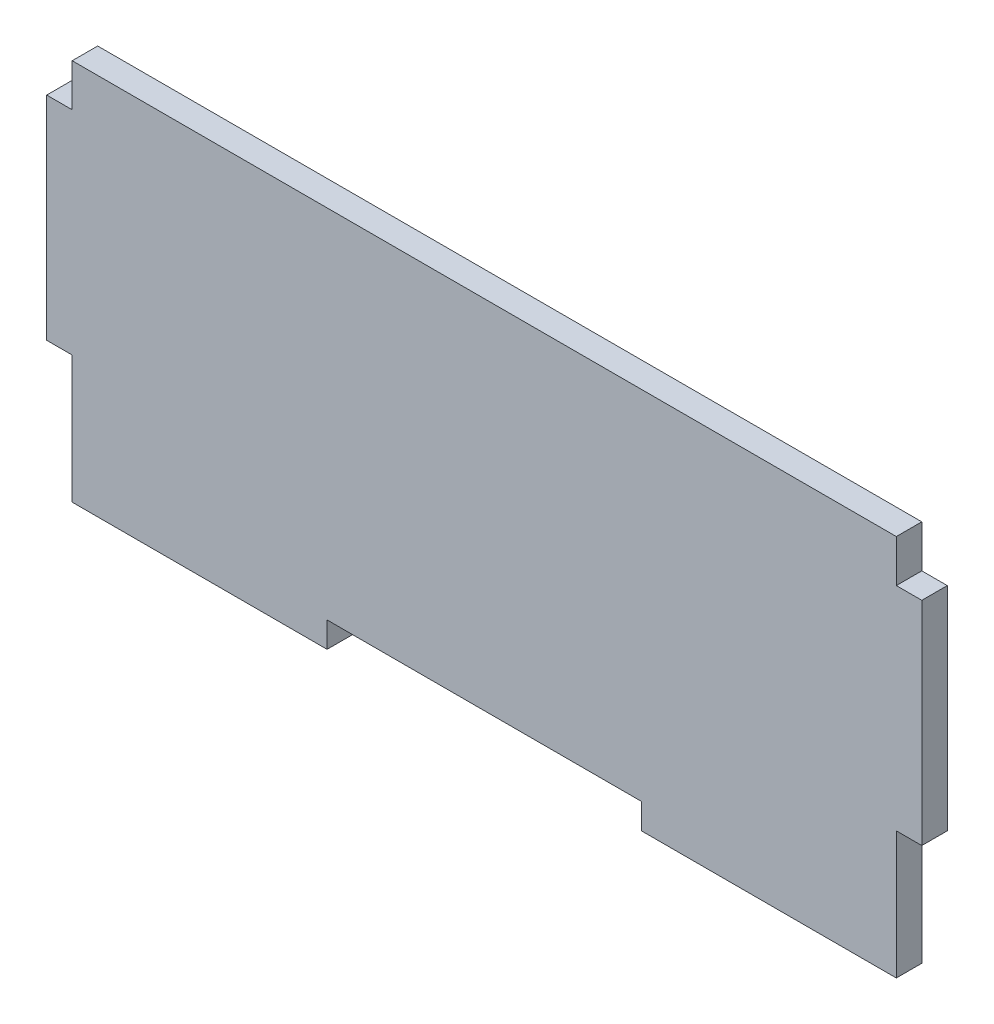
from build123d import *

# Parameters (mm, degrees)
ESBO_O1_W                = 103
ESBO_O1_H                = 55
RESSALTO_EXTRUS_O1_DEPTH = 3
ESBO_O2_W                = 3
ESBO_O2_H                = 15
CORTE_EXTRUS_O1_DEPTH    = 59.459387612
ESBO_O3_W                = 37
ESBO_O3_H                = 3
CORTE_EXTRUS_O2_DEPTH    = 59.459387612
ESBO_O4_W                = 97
ESBO_O4_H                = 10
CORTE_EXTRUS_O3_DEPTH    = 10


with BuildPart() as part:
    # Esboço1 → Ressalto-extrusão1 (new body)
    with BuildSketch(Plane.XY):
        Rectangle(ESBO_O1_W, ESBO_O1_H)
    extrude(amount=RESSALTO_EXTRUS_O1_DEPTH)

    # Esboço2 → Corte-extrusão1 (cut, through all)
    with BuildSketch(Plane(origin=(0, 0, 0), x_dir=(-1, 0, 0), z_dir=(0, 0, -1))):
        with Locations((-50, 20)):
            Rectangle(ESBO_O2_W, ESBO_O2_H)
        with Locations((-50, -20)):
            Rectangle(ESBO_O2_W, ESBO_O2_H)
        with Locations((50, 20)):
            Rectangle(ESBO_O2_W, ESBO_O2_H)
        with Locations((50, -20)):
            Rectangle(ESBO_O2_W, ESBO_O2_H)
    extrude(amount=-CORTE_EXTRUS_O1_DEPTH, mode=Mode.SUBTRACT)

    # Esboço3 → Corte-extrusão2 (cut, through all)
    with BuildSketch(Plane(origin=(0, 0, 0), x_dir=(-1, 0, 0), z_dir=(0, 0, -1))):
        with Locations((0, -26)):
            Rectangle(ESBO_O3_W, ESBO_O3_H)
    extrude(amount=-CORTE_EXTRUS_O2_DEPTH, mode=Mode.SUBTRACT)

    # Esboço4 → Corte-extrusão3 (cut)
    with BuildSketch(Plane(origin=(0, 0, 0), x_dir=(-1, 0, 0), z_dir=(0, 0, -1))):
        with Locations((0, 22.5)):
            Rectangle(ESBO_O4_W, ESBO_O4_H)
    extrude(amount=-CORTE_EXTRUS_O3_DEPTH, mode=Mode.SUBTRACT)


solid = part.part
